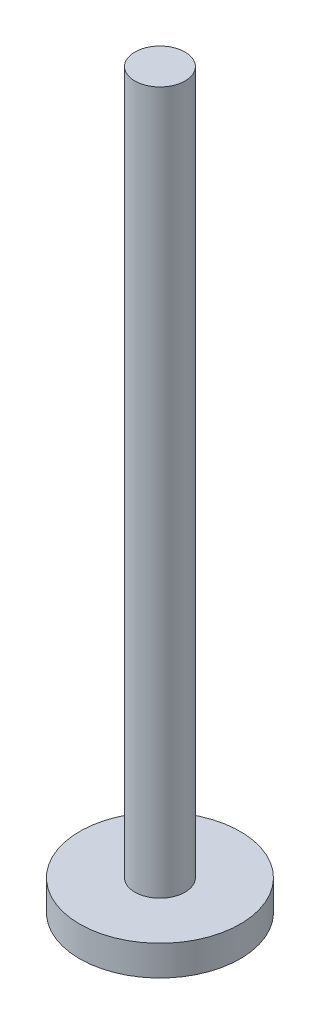
from build123d import *

# Parameters (mm, degrees)
SKETCH_1_R      = 8
EXTRUDE_1_DEPTH = 3
SKETCH_2_R      = 2.5
EXTRUDE_2_DEPTH = 70


with BuildPart() as part:
    # 草图1 → 凸台-拉伸1 (new body)
    with BuildSketch(Plane(origin=(0, 0, 0), x_dir=(1, 0, 0), z_dir=(0, 1, 0))):
        with Locations(Location((0, 0, 0), (0, 0, 270))):
            Circle(SKETCH_1_R)
    extrude(amount=EXTRUDE_1_DEPTH)

    # 草图2 → 凸台-拉伸2 (add)
    with BuildSketch(Plane(origin=(0, 3, 0), x_dir=(1, 0, 0), z_dir=(0, 1, 0))):
        with Locations(Location((0, 0, 0), (0, 0, 270))):
            Circle(SKETCH_2_R)
    extrude(amount=EXTRUDE_2_DEPTH)


solid = part.part
